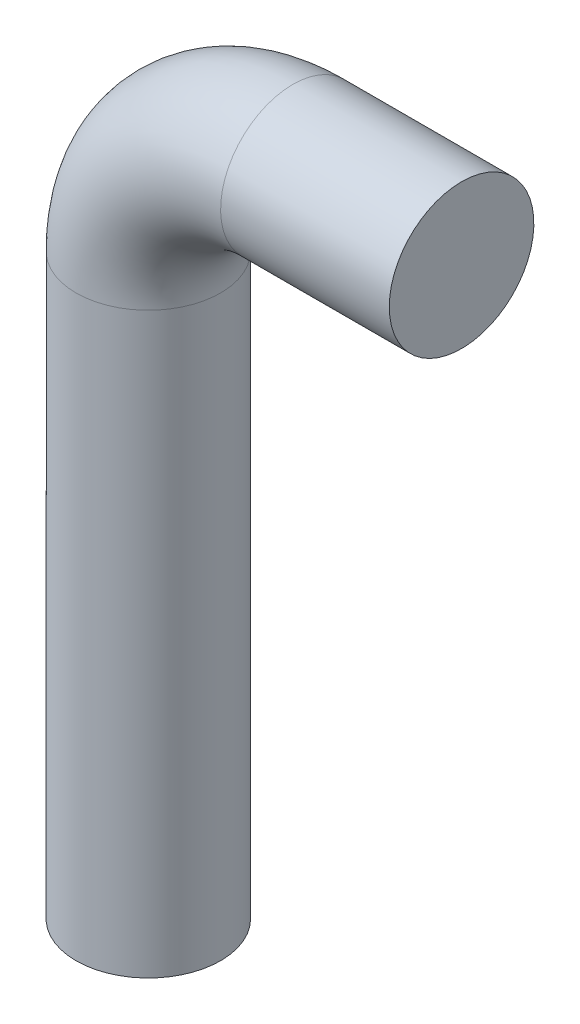
from build123d import *

# Parameters (mm, degrees)
SKETCH2_R = 1.5


with BuildPart() as part:
    # Sweep1: sweep along a path in Sketch1
    with BuildLine(Plane.XY) as sweep1_path:
        Line((0, 0), (0, 12))
        ThreePointArc((0, 12), (0.878679656, 14.121320344), (3, 15))
        Line((3, 15), (6.5, 15))
    # Sketch2 → Sweep1 (sweep)
    with BuildSketch(Plane(origin=(0, 0, 0), x_dir=(1, 0, 0), z_dir=(0, 1, 0))):
        Circle(SKETCH2_R)
    sweep(path=sweep1_path.line)


solid = part.part
